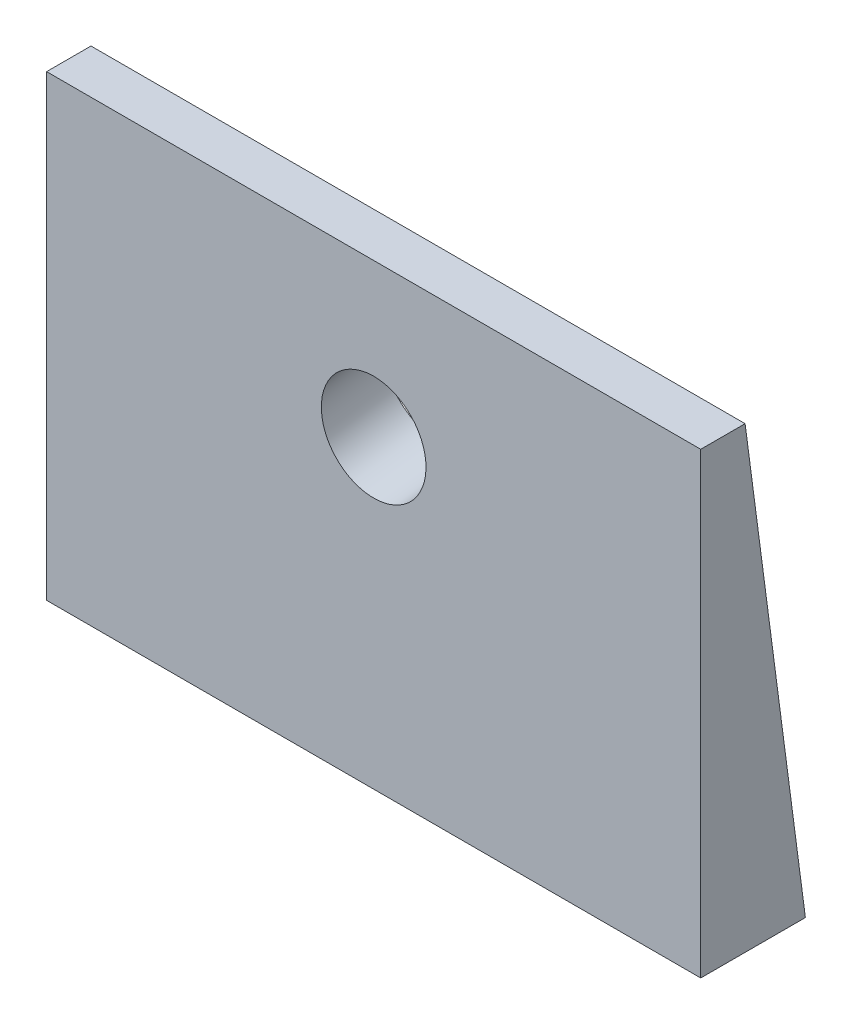
from build123d import *

# Parameters (mm, degrees)
BOSS_EXTRUDE2_DEPTH     = 125
CUT_EXTRUDE1_DEPTH      = 225.548075315
CUT_EXTRUDE1_DEPTH_BACK = 225.548075315
SKETCH9_R               = 20


with BuildPart() as part:
    # Sketch7 → Boss-Extrude2 (new, symmetric)
    with BuildSketch(Plane(origin=(0, 0, 0), x_dir=(0, 0, -1), z_dir=(1, 0, 0))):
        Polygon((0, 6.47), (-40, 6.47), (-40, 181.47), (-23.039187078, 181.47), align=None)
    extrude(amount=BOSS_EXTRUDE2_DEPTH, both=True)

    # Sketch9 → Cut-Extrude1 (cut, two sides: drawn at the far end of the back side and taken through both)
    with BuildSketch(Plane(origin=(0, 0.893387105, -6.785948779), x_dir=(-1, 0, 0), z_dir=(0, 0.130526192220056, -0.9914448613738098)).offset(-CUT_EXTRUDE1_DEPTH_BACK)):
        with Locations(Location((0, 127.16, 0), (0, 0, 90))):
            Circle(SKETCH9_R)
    extrude(amount=CUT_EXTRUDE1_DEPTH + CUT_EXTRUDE1_DEPTH_BACK, mode=Mode.SUBTRACT)


solid = part.part
